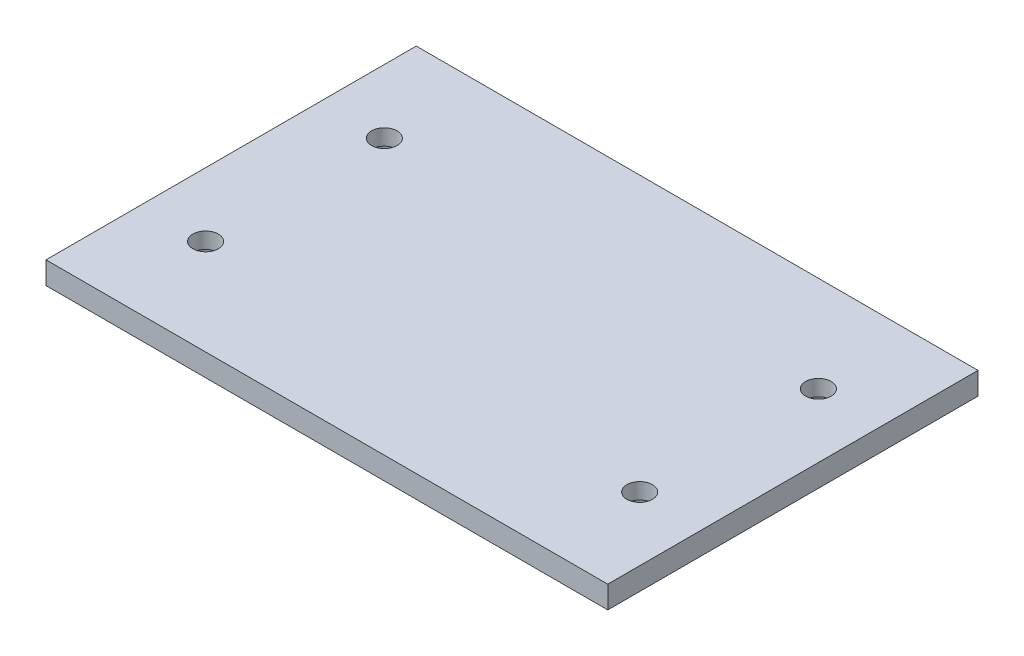
from build123d import *

# Parameters (mm, degrees)
SKETCH1_W           = 880
SKETCH1_H           = 580
BOSS_EXTRUDE1_DEPTH = 35
SKETCH2_R           = 20
CUT_EXTRUDE1_DEPTH  = 202
SKETCH3_R           = 25
CUT_EXTRUDE2_DEPTH  = 10


with BuildPart() as part:
    # Sketch1 → Boss-Extrude1 (new body)
    with BuildSketch(Plane(origin=(0, 0, 0), x_dir=(1, 0, 0), z_dir=(0, 1, 0))):
        Rectangle(SKETCH1_W, SKETCH1_H)
    extrude(amount=BOSS_EXTRUDE1_DEPTH)

    # Sketch2 → Cut-Extrude1 (cut)
    with BuildSketch(Plane.XZ):
        with Locations(Location((-340, 140, 0), (0, 0, 270))):
            Circle(SKETCH2_R)
        with Locations(Location((340, 140, 0), (0, 0, 270))):
            Circle(SKETCH2_R)
        with Locations(Location((340, -140, 0), (0, 0, 90))):
            Circle(SKETCH2_R)
        with Locations(Location((-340, -140, 0), (0, 0, 90))):
            Circle(SKETCH2_R)
    extrude(amount=-CUT_EXTRUDE1_DEPTH, mode=Mode.SUBTRACT)

    # Sketch3 → Cut-Extrude2 (cut)
    with BuildSketch(Plane.XZ):
        with Locations(Location((-340, 140, 0), (0, 0, 270))):
            Circle(SKETCH3_R)
        with Locations(Location((340, 140, 0), (0, 0, 270))):
            Circle(SKETCH3_R)
        with Locations(Location((340, -140, 0), (0, 0, 270))):
            Circle(SKETCH3_R)
        with Locations(Location((-340, -140, 0), (0, 0, 270))):
            Circle(SKETCH3_R)
    extrude(amount=-CUT_EXTRUDE2_DEPTH, mode=Mode.SUBTRACT)


solid = part.part
